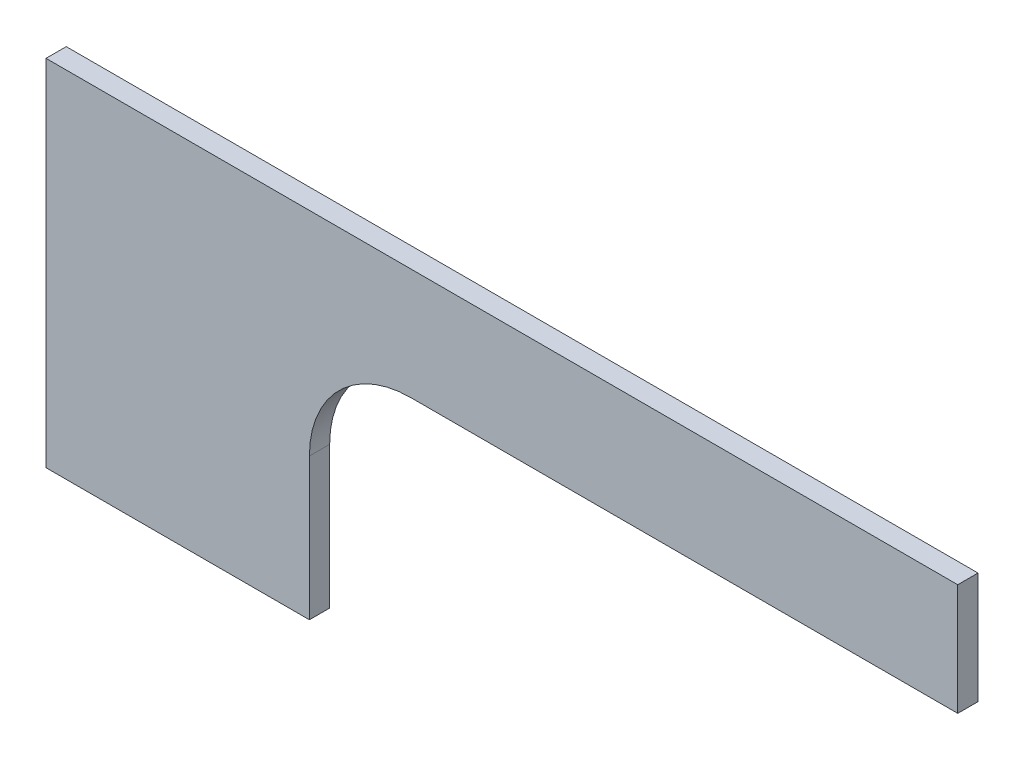
from build123d import *

# Parameters (mm, degrees)
BOSS_EXTRUDE1_DEPTH = 2
FILLET2_R           = 10


with BuildPart() as part:
    # Sketch1 → Boss-Extrude1 (new body)
    with BuildSketch(Plane.XY):
        Polygon((-18.20886328, -17.19233572), (-18.20886328, 6.80766428), (45.79113672, 6.80766428), (45.79113672, 17.80766428), (-44.20886328, 17.80766428), (-44.20886328, -17.19233572), align=None)
    extrude(amount=BOSS_EXTRUDE1_DEPTH)

    # Fillet2
    fillet2_edges = [part.edges().sort_by_distance(p)[0] for p in [
        (-18.20886328, 6.80766428, 1),
    ]]
    fillet(fillet2_edges, radius=FILLET2_R)


solid = part.part
